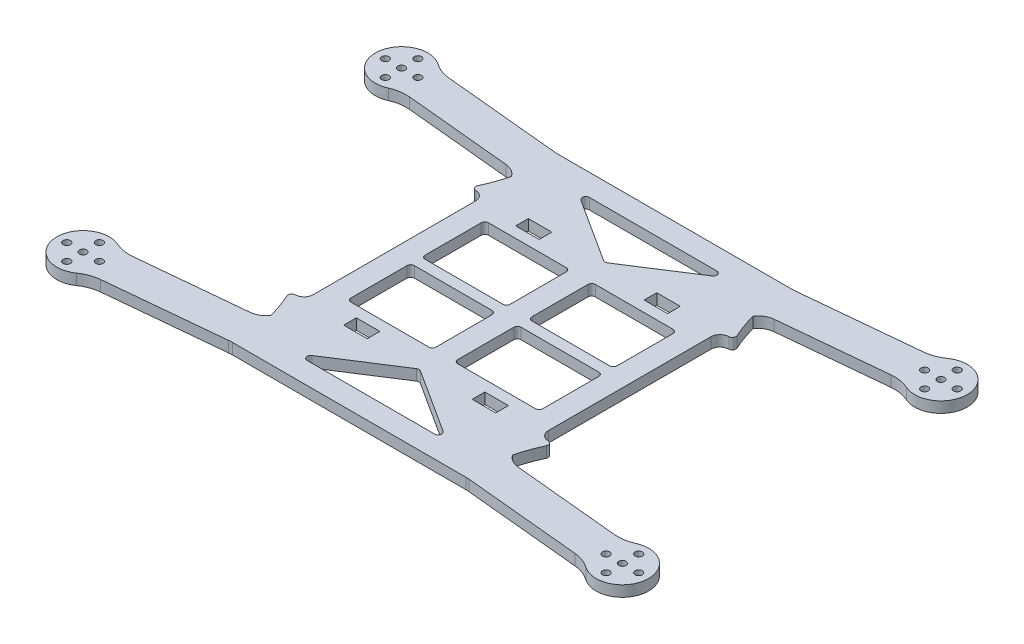
from build123d import *

# Parameters (mm, degrees)
SKETCH1_R           = 1
SKETCH1_R_2         = 0.999999999
SKETCH1_R_3         = 1.000000001
SKETCH1_R_4         = 1.000000003
SKETCH1_R_5         = 0.999999997
BOSS_EXTRUDE1_DEPTH = 3
SKETCH2_W           = 6.5
SKETCH2_H           = 3.5
CUT_EXTRUDE1_DEPTH  = 3


with BuildPart() as part:
    # Sketch1 → Boss-Extrude1 (new body)
    with BuildSketch(Plane(origin=(0, 0, 0), x_dir=(1, 0, 0), z_dir=(0, 1, 0))):
        with BuildLine():
            Line((-65.541413555, 48.16007559), (-33.218669872, 45.046086874))
            ThreePointArc((-33.218669872, 45.046086874), (-32.739740879, 45.011528364), (-32.25970508, 45))
            Line((-32.25970508, 45), (32.25970508, 45))
            ThreePointArc((32.25970508, 45), (32.739740879, 45.011528364), (33.218669872, 45.046086874))
            Line((33.218669872, 45.046086874), (65.541413555, 48.16007559))
            ThreePointArc((65.541413555, 48.16007559), (68.051615849, 48.735029299), (70.331753828, 49.931966272))
            ThreePointArc((70.331753828, 49.931966272), (81.716587017, 44.695249474), (71.540883348, 37.381380156))
            ThreePointArc((71.540883348, 37.381380156), (69.074176187, 38.121003778), (66.500378347, 38.206162463))
            Line((66.500378347, 38.206162463), (37.020517604, 35.366058461))
            ThreePointArc((37.020517604, 35.366058461), (34.967820887, 34.700490182), (33.386772404, 33.231874971))
            ThreePointArc((33.386772404, 33.231874971), (34.463229219, 29.741424145), (35.835420758, 26.3562954))
            ThreePointArc((35.835420758, 26.3562954), (35.77253489, 25.409347753), (34.946904251, 24.941374967))
            ThreePointArc((34.946904251, 24.941374967), (33.213559493, 24.190832889), (32.5, 22.441938863))
            Line((32.5, 22.441938863), (32.5, -22.441938863))
            ThreePointArc((32.5, -22.441938863), (33.213559493, -24.190832889), (34.946904251, -24.941374967))
            ThreePointArc((34.946904251, -24.941374967), (35.77253489, -25.409347753), (35.835420758, -26.3562954))
            ThreePointArc((35.835420758, -26.3562954), (34.463229219, -29.741424145), (33.386772404, -33.231874971))
            ThreePointArc((33.386772404, -33.231874971), (34.967820887, -34.700490182), (37.020517604, -35.366058461))
            Line((37.020517604, -35.366058461), (66.500378347, -38.206162463))
            ThreePointArc((66.500378347, -38.206162463), (69.074176187, -38.121003778), (71.540883348, -37.381380156))
            ThreePointArc((71.540883348, -37.381380156), (81.716587017, -44.695249474), (70.331753828, -49.931966272))
            ThreePointArc((70.331753828, -49.931966272), (68.051615849, -48.735029299), (65.541413555, -48.16007559))
            Line((65.541413555, -48.16007559), (33.218669872, -45.046086874))
            ThreePointArc((33.218669872, -45.046086874), (32.739740879, -45.011528364), (32.25970508, -45))
            Line((32.25970508, -45), (-32.25970508, -45))
            ThreePointArc((-32.25970508, -45), (-32.739740879, -45.011528364), (-33.218669872, -45.046086874))
            Line((-33.218669872, -45.046086874), (-65.541413555, -48.16007559))
            ThreePointArc((-65.541413555, -48.16007559), (-68.051615849, -48.735029299), (-70.331753828, -49.931966272))
            ThreePointArc((-70.331753828, -49.931966272), (-81.716587017, -44.695249474), (-71.540883348, -37.381380156))
            ThreePointArc((-71.540883348, -37.381380156), (-69.074176187, -38.121003778), (-66.500378347, -38.206162463))
            Line((-66.500378347, -38.206162463), (-37.020517604, -35.366058461))
            ThreePointArc((-37.020517604, -35.366058461), (-34.967820887, -34.700490182), (-33.386772404, -33.231874971))
            ThreePointArc((-33.386772404, -33.231874971), (-34.463229219, -29.741424145), (-35.835420758, -26.3562954))
            ThreePointArc((-35.835420758, -26.3562954), (-35.77253489, -25.409347753), (-34.946904251, -24.941374967))
            ThreePointArc((-34.946904251, -24.941374967), (-33.213559493, -24.190832889), (-32.5, -22.441938863))
            Line((-32.5, -22.441938863), (-32.5, 22.441938863))
            ThreePointArc((-32.5, 22.441938863), (-33.213559493, 24.190832889), (-34.946904251, 24.941374967))
            ThreePointArc((-34.946904251, 24.941374967), (-35.77253489, 25.409347753), (-35.835420758, 26.3562954))
            ThreePointArc((-35.835420758, 26.3562954), (-34.463229219, 29.741424145), (-33.386772404, 33.231874971))
            ThreePointArc((-33.386772404, 33.231874971), (-34.967820887, 34.700490182), (-37.020517604, 35.366058461))
            Line((-37.020517604, 35.366058461), (-66.500378347, 38.206162463))
            ThreePointArc((-66.500378347, 38.206162463), (-69.074176187, 38.121003778), (-71.540883348, 37.381380156))
            ThreePointArc((-71.540883348, 37.381380156), (-81.716587017, 44.695249474), (-70.331753828, 49.931966272))
            ThreePointArc((-70.331753828, 49.931966272), (-68.051615849, 48.735029299), (-65.541413555, 48.16007559))
        make_face()
        with Locations(Location((-79, 44, 0), (0, 0, 270))):
            Circle(SKETCH1_R, mode=Mode.SUBTRACT)
        with Locations(Location((79, -44, 0), (0, 0, 270))):
            Circle(SKETCH1_R, mode=Mode.SUBTRACT)
        with Locations(Location((79, 44, 0), (0, 0, 270))):
            Circle(SKETCH1_R, mode=Mode.SUBTRACT)
        with Locations(Location((-74.500002545, 48.500002545, 0), (0, 0, 270))):
            Circle(SKETCH1_R_2, mode=Mode.SUBTRACT)
        with Locations(Location((-70, 44.00000509, 0), (0, 0, 270))):
            Circle(SKETCH1_R_3, mode=Mode.SUBTRACT)
        with Locations(Location((-74.499997455, 39.500002545, 0), (0, 0, 270))):
            Circle(SKETCH1_R_4, mode=Mode.SUBTRACT)
        with Locations(Location((-74.499997455, -39.500002545, 0), (0, 0, 270))):
            Circle(SKETCH1_R_3, mode=Mode.SUBTRACT)
        with Locations(Location((-70, -44.00000509, 0), (0, 0, 270))):
            Circle(SKETCH1_R_2, mode=Mode.SUBTRACT)
        with Locations(Location((-74.500002545, -48.500002545, 0), (0, 0, 270))):
            Circle(SKETCH1_R_5, mode=Mode.SUBTRACT)
        with Locations(Location((-79, -44, 0), (0, 0, 270))):
            Circle(SKETCH1_R, mode=Mode.SUBTRACT)
        with Locations(Location((74.500002545, -48.500002545, 0), (0, 0, 270))):
            Circle(SKETCH1_R_3, mode=Mode.SUBTRACT)
        with Locations(Location((70, -44.00000509, 0), (0, 0, 270))):
            Circle(SKETCH1_R_2, mode=Mode.SUBTRACT)
        with Locations(Location((74.499997455, -39.500002545, 0), (0, 0, 270))):
            Circle(SKETCH1_R_5, mode=Mode.SUBTRACT)
        with Locations(Location((74.499997455, 39.500002545, 0), (0, 0, 270))):
            Circle(SKETCH1_R_2, mode=Mode.SUBTRACT)
        with Locations(Location((70, 44.00000509, 0), (0, 0, 270))):
            Circle(SKETCH1_R_3, mode=Mode.SUBTRACT)
        with Locations(Location((74.500002545, 48.500002545, 0), (0, 0, 270))):
            Circle(SKETCH1_R_4, mode=Mode.SUBTRACT)
        with Locations(Location((-74.5, -44, 0), (0, 0, 270))):
            Circle(SKETCH1_R, mode=Mode.SUBTRACT)
        with Locations(Location((-74.5, 44, 0), (0, 0, 270))):
            Circle(SKETCH1_R, mode=Mode.SUBTRACT)
        with Locations(Location((74.5, 44, 0), (0, 0, 270))):
            Circle(SKETCH1_R, mode=Mode.SUBTRACT)
        with Locations(Location((74.5, -44, 0), (0, 0, 270))):
            Circle(SKETCH1_R, mode=Mode.SUBTRACT)
    extrude(amount=BOSS_EXTRUDE1_DEPTH)

    # Sketch2 → Cut-Extrude1 (cut)
    with BuildSketch(Plane(origin=(0, 3, 0), x_dir=(1, 0, 0), z_dir=(0, 1, 0))):
        with Locations((-17.75, 23.75)):
            Rectangle(SKETCH2_W, SKETCH2_H)
        with Locations((-17.75, -23.75)):
            Rectangle(SKETCH2_W, SKETCH2_H)
        with Locations((17.75, -23.75)):
            Rectangle(SKETCH2_W, SKETCH2_H)
        with Locations((17.75, 23.75)):
            Rectangle(SKETCH2_W, SKETCH2_H)
        with BuildLine():
            Line((-25.5, 19), (-4, 19))
            ThreePointArc((-4, 19), (-3.292893219, 18.707106781), (-3, 18))
            Line((-3, 18), (-3, 2.5))
            ThreePointArc((-3, 2.5), (-3.292893219, 1.792893219), (-4, 1.5))
            Line((-4, 1.5), (-25.5, 1.5))
            ThreePointArc((-25.5, 1.5), (-26.207106781, 1.792893219), (-26.5, 2.5))
            Line((-26.5, 2.5), (-26.5, 18))
            ThreePointArc((-26.5, 18), (-26.207106781, 18.707106781), (-25.5, 19))
        make_face()
        with BuildLine():
            Line((-25.5, -1.5), (-4, -1.5))
            ThreePointArc((-4, -1.5), (-3.292893219, -1.792893219), (-3, -2.5))
            Line((-3, -2.5), (-3, -18))
            ThreePointArc((-3, -18), (-3.292893219, -18.707106781), (-4, -19))
            Line((-4, -19), (-25.5, -19))
            ThreePointArc((-25.5, -19), (-26.207106781, -18.707106781), (-26.5, -18))
            Line((-26.5, -18), (-26.5, -2.5))
            ThreePointArc((-26.5, -2.5), (-26.207106781, -1.792893219), (-25.5, -1.5))
        make_face()
        with BuildLine():
            Line((4, 19), (25.5, 19))
            ThreePointArc((25.5, 19), (26.207106781, 18.707106781), (26.5, 18))
            Line((26.5, 18), (26.5, 2.5))
            ThreePointArc((26.5, 2.5), (26.207106781, 1.792893219), (25.5, 1.5))
            Line((25.5, 1.5), (4, 1.5))
            ThreePointArc((4, 1.5), (3.292893219, 1.792893219), (3, 2.5))
            Line((3, 2.5), (3, 18))
            ThreePointArc((3, 18), (3.292893219, 18.707106781), (4, 19))
        make_face()
        with BuildLine():
            Line((4, -1.5), (25.5, -1.5))
            ThreePointArc((25.5, -1.5), (26.207106781, -1.792893219), (26.5, -2.5))
            Line((26.5, -2.5), (26.5, -18))
            ThreePointArc((26.5, -18), (26.207106781, -18.707106781), (25.5, -19))
            Line((25.5, -19), (4, -19))
            ThreePointArc((4, -19), (3.292893219, -18.707106781), (3, -18))
            Line((3, -18), (3, -2.5))
            ThreePointArc((3, -2.5), (3.292893219, -1.792893219), (4, -1.5))
        make_face()
        with BuildLine():
            Line((-17.595187003, 39), (17.595187003, 39))
            ThreePointArc((17.595187003, 39), (18.554660419, 38.281799152), (18.135944594, 37.158821525))
            Line((18.135944594, 37.158821525), (0.540757591, 25.84762988))
            ThreePointArc((0.540757591, 25.84762988), (0, 25.688808356), (-0.540757591, 25.84762988))
            Line((-0.540757591, 25.84762988), (-18.135944594, 37.158821525))
            ThreePointArc((-18.135944594, 37.158821525), (-18.554660419, 38.281799152), (-17.595187003, 39))
        make_face()
        with BuildLine():
            Line((-17.595187003, -39), (17.595187003, -39))
            ThreePointArc((17.595187003, -39), (18.554660419, -38.281799152), (18.135944594, -37.158821525))
            Line((18.135944594, -37.158821525), (0.540757591, -25.84762988))
            ThreePointArc((0.540757591, -25.84762988), (0, -25.688808356), (-0.540757591, -25.84762988))
            Line((-0.540757591, -25.84762988), (-18.135944594, -37.158821525))
            ThreePointArc((-18.135944594, -37.158821525), (-18.554660419, -38.281799152), (-17.595187003, -39))
        make_face()
    extrude(amount=-CUT_EXTRUDE1_DEPTH, mode=Mode.SUBTRACT)


solid = part.part
